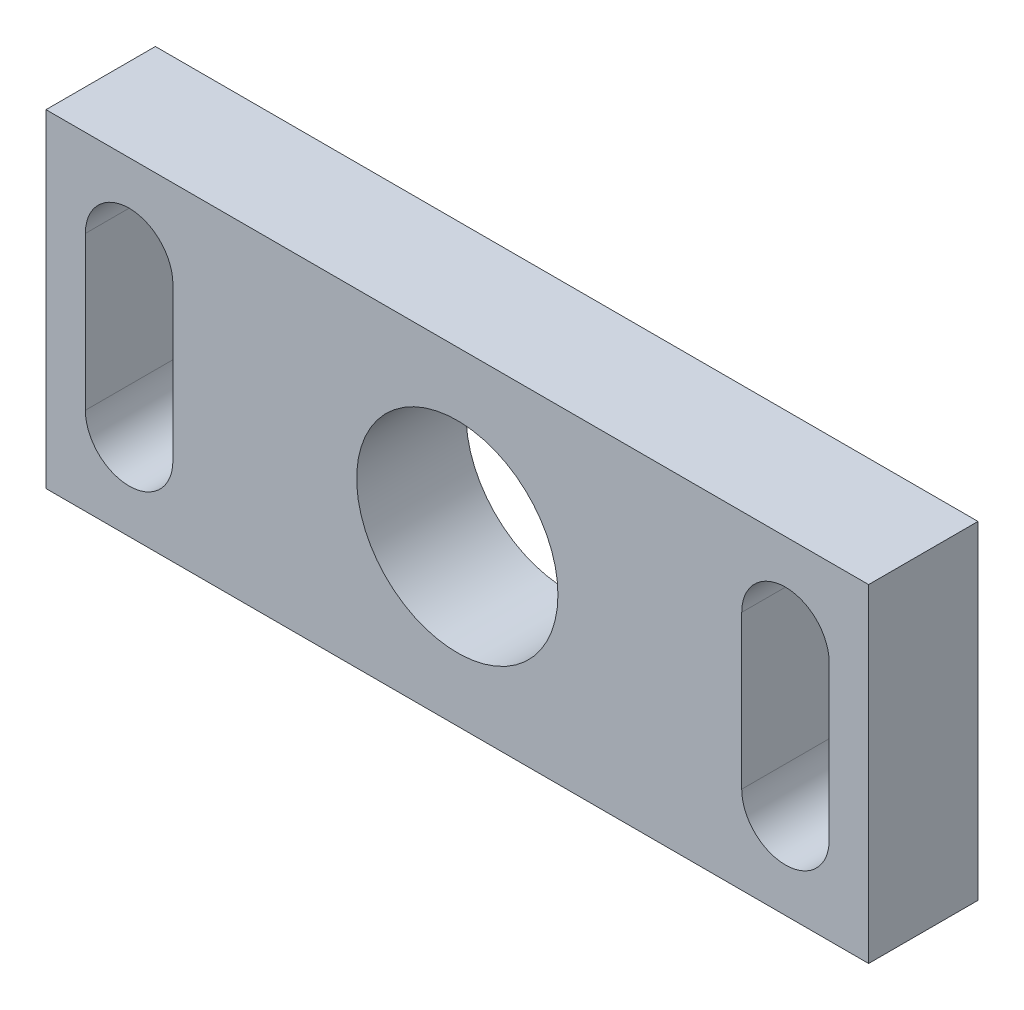
from build123d import *

# Parameters (mm, degrees)
SKETCH1_W           = 37.6
SKETCH1_H           = 15
BOSS_EXTRUDE1_DEPTH = 5
CUT_EXTRUDE1_DEPTH  = 5
SKETCH3_R           = 4.6
CUT_EXTRUDE2_DEPTH  = 5


with BuildPart() as part:
    # Sketch1 → Boss-Extrude1 (new body)
    with BuildSketch(Plane.XY):
        Rectangle(SKETCH1_W, SKETCH1_H)
    extrude(amount=BOSS_EXTRUDE1_DEPTH)

    # Sketch2 → Cut-Extrude1 (cut)
    with BuildSketch(Plane.XY.offset(5)):
        with BuildLine():
            Line((-13, 3.5), (-13, -3.5))
            ThreePointArc((-13, -3.5), (-15, -5.5), (-17, -3.5))
            Line((-17, -3.5), (-17, 3.5))
            ThreePointArc((-17, 3.5), (-15, 5.5), (-13, 3.5))
        make_face()
        with BuildLine():
            Line((17, 3.5), (17, -3.5))
            ThreePointArc((17, -3.5), (15, -5.5), (13, -3.5))
            Line((13, -3.5), (13, 3.5))
            ThreePointArc((13, 3.5), (15, 5.5), (17, 3.5))
        make_face()
    extrude(amount=-CUT_EXTRUDE1_DEPTH, mode=Mode.SUBTRACT)

    # Sketch3 → Cut-Extrude2 (cut)
    with BuildSketch(Plane.XY.offset(5)):
        Circle(SKETCH3_R)
    extrude(amount=-CUT_EXTRUDE2_DEPTH, mode=Mode.SUBTRACT)


solid = part.part
